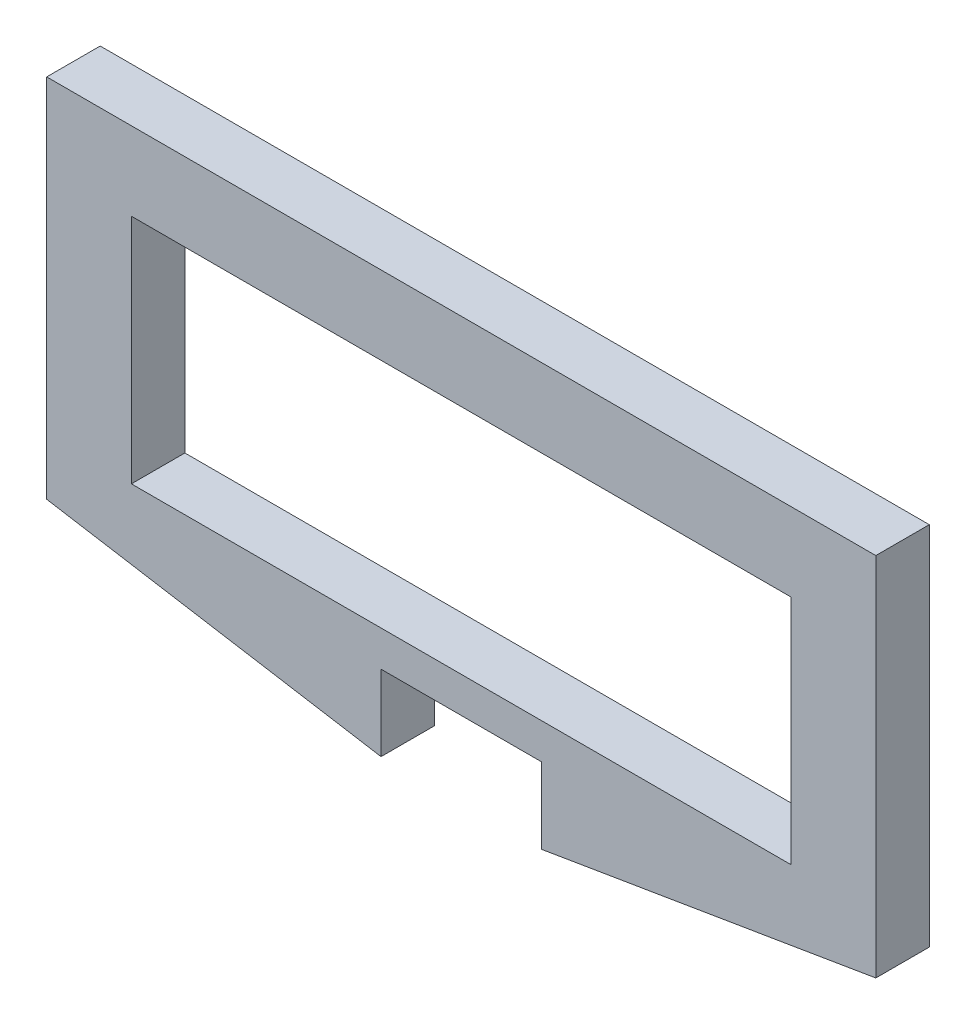
from build123d import *

# Parameters (mm, degrees)
IZIM1_W                     = 370
IZIM1_H                     = 130
Y_KSEKLIK_EKSTR_ZYON1_DEPTH = 30


with BuildPart() as part:
    # Çizim1 → Yükseklik-Ekstrüzyon1 (new body)
    with BuildSketch(Plane.XY):
        Polygon((232.49, 9.891181894), (-232.49, 9.891181894), (-232.49, -195.288818106), (-45, -226.529341406), (-45, -184.029341406), (45, -184.029341406), (45, -226.529341406), (232.49, -195.288818106), align=None)
        with Locations((0, -99.029341406)):
            Rectangle(IZIM1_W, IZIM1_H, mode=Mode.SUBTRACT)
    extrude(amount=Y_KSEKLIK_EKSTR_ZYON1_DEPTH)


solid = part.part
